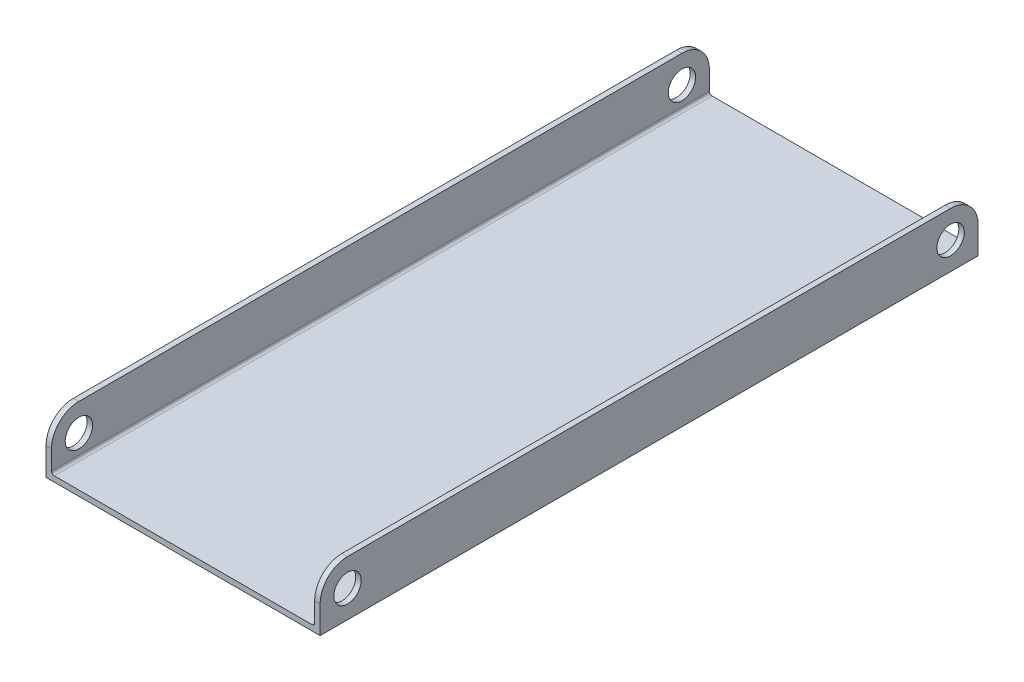
from build123d import *

# Parameters (mm, degrees)
BOSS_EXTRUDE1_DEPTH = 152.4
FILLET1_R           = 0.635
FILLET2_R           = 6.35
SKETCH3_R           = 3.175
CUT_EXTRUDE1_DEPTH  = 152.4


with BuildPart() as part:
    # Sketch1 → Boss-Extrude1 (new body)
    with BuildSketch(Plane.XY):
        Polygon((0, 0), (-63.5, 0), (-63.5, 12.7), (-62.23, 12.7), (-62.23, 1.27), (-1.27, 1.27), (-1.27, 12.7), (0, 12.7), align=None)
    extrude(amount=-BOSS_EXTRUDE1_DEPTH)

    # Fillet1
    fillet1_edges = [part.edges().sort_by_distance(p)[0] for p in [
        (-62.23, 1.27, -76.2),
        (-1.27, 1.27, -76.2),
    ]]
    fillet(fillet1_edges, radius=FILLET1_R)

    # Fillet2
    fillet2_edges = [part.edges().sort_by_distance(p)[0] for p in [
        (-0.635, 12.7, 0),
        (-62.865, 12.7, -152.4),
        (-0.635, 12.7, -152.4),
        (-62.865, 12.7, 0),
    ]]
    fillet(fillet2_edges, radius=FILLET2_R)

    # Sketch3 → Cut-Extrude1 (cut)
    with BuildSketch(Plane(origin=(0, 0, 0), x_dir=(0, 0, -1), z_dir=(1, 0, 0))):
        with Locations(Location((6.35, 6.35, 0), (0, 0, 90))):
            Circle(SKETCH3_R)
        with Locations(Location((146.05, 6.35, 0), (0, 0, 90))):
            Circle(SKETCH3_R)
    extrude(amount=-CUT_EXTRUDE1_DEPTH, mode=Mode.SUBTRACT)


solid = part.part
